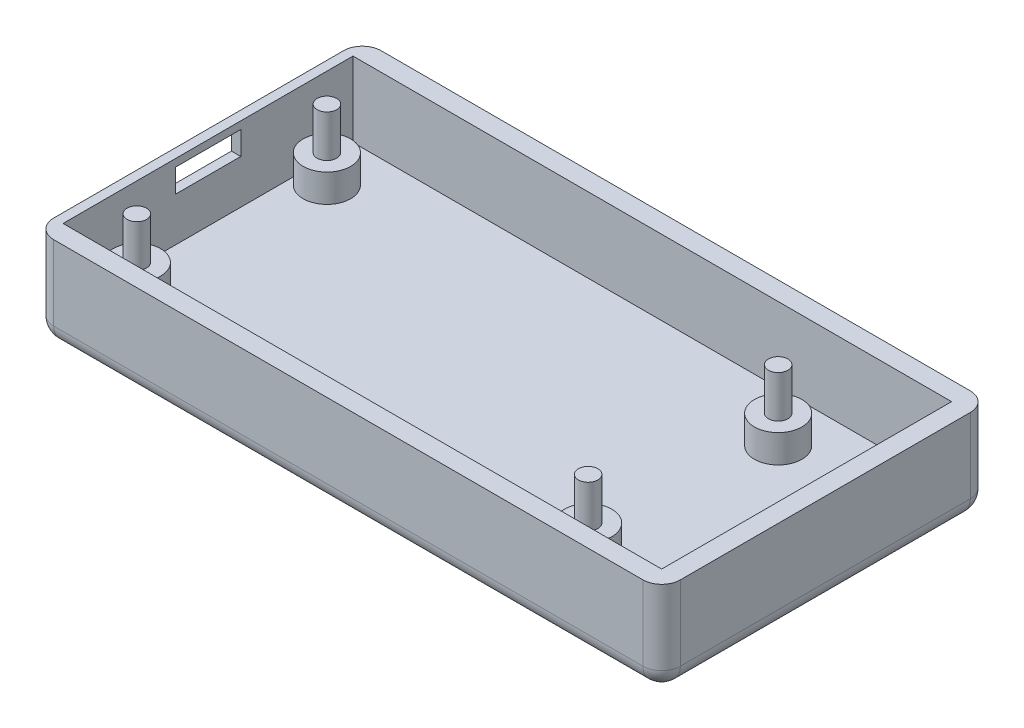
from build123d import *

# Parameters (mm, degrees)
CROQUIS1_W              = 67
CROQUIS1_H              = 35
SALIENTE_EXTRUIR1_DEPTH = 10
CORTAR_EXTRUIR1_DEPTH   = 8
CROQUIS3_R              = 2.54
SALIENTE_EXTRUIR2_DEPTH = 3
CROQUIS4_R              = 1.04
SALIENTE_EXTRUIR3_DEPTH = 4.5
CROQUIS6_W              = 7
CROQUIS6_H              = 2.5
CORTAR_EXTRUIR2_DEPTH   = 3
REDONDEO1_R             = 2
CROQUIS7_W              = 1.615384615
CROQUIS7_H              = 9
CORTAR_EXTRUIR3_DEPTH   = 0.8


with BuildPart() as part:
    # Croquis1 → Saliente-Extruir1 (new body)
    with BuildSketch(Plane(origin=(0, 0, 0), x_dir=(1, 0, 0), z_dir=(0, 1, 0))):
        with Locations((33.5, 17.5)):
            Rectangle(CROQUIS1_W, CROQUIS1_H)
    extrude(amount=SALIENTE_EXTRUIR1_DEPTH)

    # Croquis2 → Cortar-Extruir1 (cut)
    with BuildSketch(Plane(origin=(0, 10, 0), x_dir=(1, 0, 0), z_dir=(0, 1, 0))):
        Polygon((2, 2), (1, 2), (1, 33), (2, 33), (65, 33), (65, 2), align=None)
    extrude(amount=-CORTAR_EXTRUIR1_DEPTH, mode=Mode.SUBTRACT)

    # Croquis3 → Saliente-Extruir2 (add)
    with BuildSketch(Plane(origin=(0, 2, 0), x_dir=(1, 0, 0), z_dir=(0, 1, 0))):
        with Locations(Location((3.55, 27.66, 0), (0, 0, 90))):
            Circle(CROQUIS3_R)
        with Locations(Location((51.8, 27.66, 0), (0, 0, 90))):
            Circle(CROQUIS3_R)
        with Locations(Location((3.55, 7.34, 0), (0, 0, 90))):
            Circle(CROQUIS3_R)
        with Locations(Location((51.8, 7.34, 0), (0, 0, 90))):
            Circle(CROQUIS3_R)
    extrude(amount=SALIENTE_EXTRUIR2_DEPTH)

    # Croquis4 → Saliente-Extruir3 (add)
    with BuildSketch(Plane(origin=(0, 5, 0), x_dir=(1, 0, 0), z_dir=(0, 1, 0))):
        with Locations(Location((3.55, 7.34, 0), (0, 0, 270))):
            Circle(CROQUIS4_R)
        with Locations(Location((51.8, 7.34, 0), (0, 0, 270))):
            Circle(CROQUIS4_R)
        with Locations(Location((51.8, 27.66, 0), (0, 0, 270))):
            Circle(CROQUIS4_R)
        with Locations(Location((3.55, 27.66, 0), (0, 0, 270))):
            Circle(CROQUIS4_R)
    extrude(amount=SALIENTE_EXTRUIR3_DEPTH)

    # Croquis6 → Cortar-Extruir2 (cut)
    with BuildSketch(Plane.ZY):
        with Locations((-17.5, 7.95)):
            Rectangle(CROQUIS6_W, CROQUIS6_H)
    extrude(amount=-CORTAR_EXTRUIR2_DEPTH, mode=Mode.SUBTRACT)

    # Redondeo1
    redondeo1_edges = [part.edges().sort_by_distance(p)[0] for p in [
        (33.5, 0, -35),
        (67, 0, -17.5),
        (33.5, 0, 0),
        (0, 0, -17.5),
        (0, 5, -35),
        (67, 5, -35),
        (67, 5, 0),
        (0, 5, 0),
    ]]
    fillet(redondeo1_edges, radius=REDONDEO1_R)

    # Croquis7 → Cortar-Extruir3 (cut)
    # profile 1 of 4: a face of its own
    with BuildSketch(Plane.XZ):
        with BuildLine():
            Line((25.711538462, -14.267221573), (27.442307692, -14.267221573))
            Line((27.442307692, -14.267221573), (27.442307692, -19.877798496))
            add(Edge.make_bspline(
                [(27.442307692, -19.877798496), (27.440227759, -20.011873416), (27.436211325, -20.270777351), (27.405572821, -20.645996027), (27.354479168, -20.993844379), (27.280957205, -21.31481504), (27.186000054, -21.607728291), (27.069863855, -21.873557924), (26.9349099, -22.113729512), (26.82394771, -22.254067535), (26.769831731, -22.322510034)],
                knots=[0, 0, 0, 0, 1.243822755, 2.401870584, 3.490053692, 4.503076575, 5.453444971, 6.342269266, 7.191528908, 8, 8, 8, 8], degree=3))
            add(Edge.make_bspline(
                [(26.769831731, -22.322510034), (26.692120437, -22.407750462), (26.537091283, -22.577799765), (26.263766195, -22.792395968), (25.964328492, -22.975807488), (25.635722363, -23.126122019), (25.278339212, -23.240613739), (24.893097123, -23.323068183), (24.479751864, -23.374424694), (24.194265353, -23.379827971), (24.047475962, -23.382606188)],
                knots=[0, 0, 0, 0, 0.916003385, 1.827369254, 2.751972866, 3.703651841, 4.69362366, 5.730423306, 6.83304546, 8, 8, 8, 8], degree=3))
            add(Edge.make_bspline(
                [(24.047475962, -23.382606188), (23.892311083, -23.380204049), (23.593889067, -23.375584116), (23.165062782, -23.330390585), (22.774443359, -23.256027748), (22.420196454, -23.151335412), (22.099021734, -23.016252022), (21.804862655, -22.854279242), (21.538284143, -22.660627452), (21.295256738, -22.442931097), (21.081416704, -22.196409453), (20.898818295, -21.923319597), (20.743253943, -21.626173408), (20.666442275, -21.413679893), (20.627403846, -21.305683111)],
                knots=[0, 0, 0, 0, 1.29412125, 2.488928388, 3.592140377, 4.607309753, 5.564519828, 6.493640275, 7.402258018, 8.307438948, 9.210158992, 10.116782752, 11.042881838, 12, 12, 12, 12], degree=3))
            Line((20.627403846, -21.305683111), (22.423076923, -21.305683111))
            add(Edge.make_bspline(
                [(22.423076923, -21.305683111), (22.464573008, -21.351366346), (22.548092514, -21.44331336), (22.695815758, -21.559987893), (22.859231149, -21.659855604), (23.039657116, -21.741631166), (23.237845954, -21.803814147), (23.452448561, -21.851056515), (23.684426189, -21.877680062), (23.844284601, -21.880930677), (23.926682692, -21.882606188)],
                knots=[0, 0, 0, 0, 0.888971165, 1.789239437, 2.70354581, 3.646217955, 4.638595249, 5.694475788, 6.811630907, 8, 8, 8, 8], degree=3))
            add(Edge.make_bspline(
                [(23.926682692, -21.882606188), (24.030812214, -21.880660587), (24.229690473, -21.87694466), (24.511059338, -21.836315038), (24.762327252, -21.775616757), (24.979867039, -21.684267327), (25.167549209, -21.574544092), (25.324121841, -21.447086288), (25.453405298, -21.306695915), (25.537970206, -21.174622876), (25.588221821, -21.054811215), (25.622440174, -20.951355569), (25.648425959, -20.832104162), (25.672079879, -20.699288945), (25.689761569, -20.551198818), (25.701475915, -20.388147509), (25.711634011, -20.210853388), (25.711571015, -20.087550774), (25.711538462, -20.02383215)],
                knots=[0, 0, 0, 0, 1.656375485, 3.163532, 4.516250129, 5.759907703, 6.905105653, 7.965920022, 8.961443813, 9.932912751, 10.442911961, 11.026787936, 11.664959534, 12.383728702, 13.174001396, 14.037595414, 14.985895623, 16, 16, 16, 16], degree=3))
            add(Edge.make_bspline(
                [(25.711538462, -20.02383215), (25.640768953, -20.093241876), (25.502669807, -20.228687551), (25.27848742, -20.401487073), (25.048997049, -20.544215224), (24.812879847, -20.657677854), (24.565439982, -20.740787228), (24.305224149, -20.800476846), (24.029268815, -20.83684668), (23.839654479, -20.841677028), (23.742788462, -20.84414465)],
                knots=[0, 0, 0, 0, 1.082007397, 2.111422008, 3.08419067, 4.02964304, 4.965866572, 5.929243163, 6.942137121, 8, 8, 8, 8], degree=3))
            add(Edge.make_bspline(
                [(23.742788462, -20.84414465), (23.635643373, -20.841669395), (23.425172423, -20.836807117), (23.11603391, -20.789555282), (22.819442998, -20.716036036), (22.534601054, -20.61369037), (22.264414579, -20.477811527), (22.005038718, -20.316153606), (21.761280463, -20.120228077), (21.529776879, -19.900972144), (21.320538614, -19.657259579), (21.136421881, -19.395512613), (20.981206857, -19.117536772), (20.854981407, -18.823590464), (20.75441199, -18.514907664), (20.685198822, -18.189817236), (20.642904198, -17.848868081), (20.637415056, -17.616504875), (20.634615385, -17.497990804)],
                knots=[0, 0, 0, 0, 1.007560175, 1.979205489, 2.935124557, 3.879618859, 4.820364716, 5.775815361, 6.749909327, 7.75781854, 8.772289371, 9.766897274, 10.764314289, 11.762244114, 12.772609037, 13.814079916, 14.885097635, 16, 16, 16, 16], degree=3))
            add(Edge.make_bspline(
                [(20.634615385, -17.497990804), (20.63706062, -17.37163875), (20.641839527, -17.124699409), (20.688686458, -16.764012967), (20.761582549, -16.421460445), (20.865643633, -16.097758391), (21.002356546, -15.794290614), (21.167568632, -15.510094182), (21.359721402, -15.241919202), (21.511826371, -15.082827887), (21.588341346, -15.002798496)],
                knots=[0, 0, 0, 0, 1.104124469, 2.157873671, 3.173961494, 4.162551312, 5.124378318, 6.07778831, 7.033049473, 8, 8, 8, 8], degree=3))
            add(Edge.make_bspline(
                [(21.588341346, -15.002798496), (21.660952954, -14.934559306), (21.804037754, -14.800090574), (22.038267126, -14.627544874), (22.280851787, -14.479552211), (22.535119051, -14.3605088), (22.799269724, -14.265709144), (23.074867602, -14.199389261), (23.360542339, -14.15849795), (23.554550234, -14.15407386), (23.652644231, -14.151836957)],
                knots=[0, 0, 0, 0, 1.042068658, 2.053448347, 3.038272799, 4.011764631, 4.986555969, 5.970496305, 6.973845226, 8, 8, 8, 8], degree=3))
            add(Edge.make_bspline(
                [(23.652644231, -14.151836957), (23.744694344, -14.154421693), (23.927097475, -14.159543509), (24.197339667, -14.195680089), (24.45902215, -14.259520603), (24.715010163, -14.347287887), (24.968016972, -14.46098041), (25.21782394, -14.609996361), (25.469495825, -14.788177326), (25.629190429, -14.927400817), (25.711538462, -14.999192727)],
                knots=[0, 0, 0, 0, 0.968122651, 1.918396369, 2.861262201, 3.796768263, 4.761417965, 5.77287463, 6.85156174, 8, 8, 8, 8], degree=3))
            Line((25.711538462, -14.999192727), (25.711538462, -14.267221573))
        make_face()
        with BuildLine():
            add(Edge.make_bspline(
                [(24.038461538, -15.651836957), (23.975307595, -15.653871992), (23.850973758, -15.657878449), (23.668242267, -15.680451227), (23.494829238, -15.723059514), (23.328621173, -15.778384882), (23.171638876, -15.852808461), (23.023578873, -15.943611188), (22.882686183, -16.049008098), (22.75344409, -16.170988063), (22.633645532, -16.302790204), (22.533058483, -16.447845977), (22.443417491, -16.597895666), (22.373708321, -16.758977199), (22.316064952, -16.926719163), (22.280835706, -17.104535023), (22.252686448, -17.289174644), (22.250907113, -17.415540231), (22.25, -17.479961957)],
                knots=[0, 0, 0, 0, 1.059154978, 2.085203149, 3.079850876, 4.048488546, 5.017545358, 5.985239295, 6.956545898, 7.961752598, 8.960830395, 9.936516972, 10.916356752, 11.886198968, 12.873933111, 13.883774911, 14.921139228, 16, 16, 16, 16], degree=3))
            add(Edge.make_bspline(
                [(22.25, -17.479961957), (22.250981913, -17.546768187), (22.252909039, -17.677883644), (22.279890568, -17.868894374), (22.318433284, -18.051703138), (22.376655231, -18.224078422), (22.449543733, -18.388285143), (22.537099744, -18.54424261), (22.645182745, -18.688221951), (22.765205229, -18.823391732), (22.897982527, -18.945600678), (23.040905541, -19.051896201), (23.191031752, -19.143693325), (23.351606393, -19.215265932), (23.51915513, -19.273264564), (23.695358442, -19.315383162), (23.879811409, -19.338139602), (24.005351386, -19.342122047), (24.069110577, -19.34414465)],
                knots=[0, 0, 0, 0, 1.097915424, 2.154794285, 3.166904039, 4.167166757, 5.140698173, 6.119085138, 7.101657521, 8.095747232, 9.089148684, 10.06378348, 11.021581144, 11.977080764, 12.949256321, 13.934658686, 14.951055324, 16, 16, 16, 16], degree=3))
            add(Edge.make_bspline(
                [(24.069110577, -19.34414465), (24.131714439, -19.343163071), (24.254460825, -19.341238505), (24.433513095, -19.314240618), (24.604582804, -19.275203956), (24.767361861, -19.219381435), (24.920946879, -19.146520928), (25.067398791, -19.059572962), (25.203611065, -18.954356031), (25.332166988, -18.835401051), (25.448180504, -18.703126262), (25.550581602, -18.559808264), (25.634700395, -18.405421175), (25.706352399, -18.242409276), (25.759403691, -18.06847309), (25.799684478, -17.885339833), (25.823312953, -17.692122327), (25.825704169, -17.559954103), (25.826923077, -17.49258215)],
                knots=[0, 0, 0, 0, 1.047368431, 2.053558439, 3.025081491, 3.983010266, 4.928381778, 5.867249904, 6.829345556, 7.804873619, 8.796055618, 9.770545002, 10.747991713, 11.735078325, 12.747239243, 13.787476531, 14.872179528, 16, 16, 16, 16], degree=3))
            add(Edge.make_bspline(
                [(25.826923077, -17.49258215), (25.825740513, -17.425805294), (25.823431497, -17.295420131), (25.799469354, -17.104657651), (25.759538632, -16.923821538), (25.705752493, -16.751419338), (25.635657115, -16.588480601), (25.54775782, -16.43652184), (25.447241242, -16.29273707), (25.328886459, -16.162023984), (25.201317544, -16.041126622), (25.060675994, -15.938850036), (24.91399536, -15.848482136), (24.756323144, -15.776841661), (24.589617797, -15.720415781), (24.413611576, -15.681817268), (24.229202108, -15.654732128), (24.102867482, -15.652814548), (24.038461538, -15.651836957)],
                knots=[0, 0, 0, 0, 1.111098411, 2.169475416, 3.193737863, 4.190319778, 5.171520483, 6.139320596, 7.107999188, 8.085777416, 9.069626166, 10.027970922, 10.974971434, 11.932846196, 12.904000912, 13.89897495, 14.928888274, 16, 16, 16, 16], degree=3))
        make_face(mode=Mode.SUBTRACT)
    # profile 2 of 4: a face of its own
    with BuildSketch(Plane.XZ):
        Polygon((28.538461538, -11.84414465), (30.263822115, -11.84414465), (32.576923077, -18.237173496), (34.895432692, -11.84414465), (36.615384615, -11.84414465), (33.352163462, -20.84414465), (31.796274038, -20.84414465), align=None)
    # profile 3 of 4: a face of its own
    with BuildSketch(Plane.XZ):
        with Locations((38.634615385, -16.34414465)):
            Rectangle(CROQUIS7_W, CROQUIS7_H)
    # profile 4 of 4: a face of its own
    with BuildSketch(Plane.XZ):
        Polygon((41.519230769, -11.84414465), (46.365384615, -11.84414465), (46.365384615, -13.459529265), (43.134615385, -13.459529265), (43.134615385, -15.190298496), (46.365384615, -15.190298496), (46.365384615, -16.805683111), (43.134615385, -16.805683111), (43.134615385, -19.228760034), (46.365384615, -19.228760034), (46.365384615, -20.84414465), (41.519230769, -20.84414465), align=None)
    extrude(amount=-CORTAR_EXTRUIR3_DEPTH, mode=Mode.SUBTRACT)


solid = part.part
